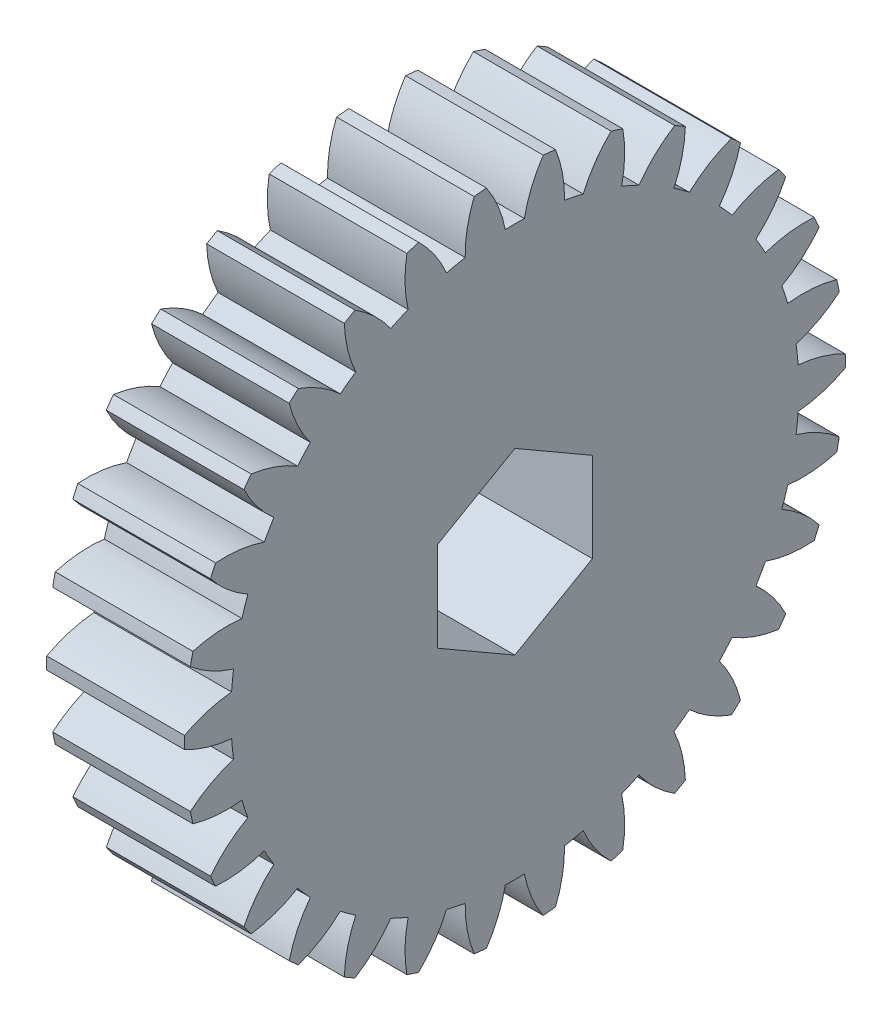
from build123d import *

# Parameters (mm, degrees)
BASPROSKE_W              = 15
BASPROSKE_H              = 24
TOOTHCUT_DEPTH           = 38.107950631
TEETHCUTS_COUNT          = 30
TEETHCUTS_ANGLE          = 348
BORSKE_R                 = 5
BORE_DEPTH               = 50.0000508
CORTE_EXTRUS_O1_DEPTH    = 38.050491393
ESBO_O2_R                = 30.603366169
CORTE_EXTRUS_O2_DEPTH    = 5
ESBO_O4_R                = 9.5
ESBO_O4_R_2              = 7.5
RESSALTO_EXTRUS_O1_DEPTH = 1


with BuildPart() as part:
    # BasProSke → Base-Revolve (revolve)
    with BuildSketch(Plane(origin=(0, 0, 0), x_dir=(1, 0, 0), z_dir=(0, 1, 0)), mode=Mode.PRIVATE) as base_revolve_sk:
        with Locations((7.5, 12)):
            Rectangle(BASPROSKE_W, BASPROSKE_H)
    revolve(base_revolve_sk.sketch.rotate(Axis((-10, 0, 0), (1, 0, 0)), 180), axis=Axis((-10, 0, 0), (1, 0, 0)))

    # TooCutSke → ToothCut (cut, through all)
    with BuildSketch(Plane(origin=(0, 0, 0), x_dir=(0, 0, -1), z_dir=(1, 0, 0))):
        with BuildLine():
            ThreePointArc((0.693278797, 20.612344372), (0, 20.624), (-0.693278797, 20.612344372))
            ThreePointArc((-0.693278797, 20.612344372), (-1.219042225, 22.34383125), (-2.080549663, 23.935144835))
            ThreePointArc((-2.080549663, 23.935144835), (0, 24.0254), (2.080549663, 23.935144835))
            ThreePointArc((2.080549663, 23.935144835), (1.219042225, 22.34383125), (0.693278797, 20.612344372))
        make_face()
    toothcut = extrude(amount=TOOTHCUT_DEPTH, mode=Mode.SUBTRACT)

    # TeethCuts: ToothCut ×30 about axis
    teethcuts_axis = Axis((-10, 0, 0), (1, 0, 0))
    for i in range(1, TEETHCUTS_COUNT):
        add(toothcut.rotate(teethcuts_axis, i * TEETHCUTS_ANGLE / (TEETHCUTS_COUNT - 1)), mode=Mode.SUBTRACT)

    # BorSke → Bore (cut, symmetric)
    with BuildSketch(Plane(origin=(0, 0, 0), x_dir=(0, 0, -1), z_dir=(1, 0, 0))):
        with Locations(Location((0, 0, 0), (0, 0, 180))):
            Circle(BORSKE_R)
    extrude(amount=BORE_DEPTH, both=True, mode=Mode.SUBTRACT)

    # Esboço1 → Corte-extrusão1 (cut, through all)
    with BuildSketch(Plane(origin=(15, 0, 0), x_dir=(0, 0, -1), z_dir=(1, 0, 0))):
        Polygon((0, 6.5), (-5.629165125, 3.25), (-5.629165125, -3.25), (0, -6.5), (5.629165125, -3.25), (5.629165125, 3.25), align=None)
    extrude(amount=-CORTE_EXTRUS_O1_DEPTH, mode=Mode.SUBTRACT)

    # Esboço2 → Corte-extrusão2 (cut)
    with BuildSketch(Plane.ZY):
        Circle(ESBO_O2_R)
    extrude(amount=-CORTE_EXTRUS_O2_DEPTH, mode=Mode.SUBTRACT)

    # Esboço4 → Ressalto-extrusão1 (add)
    with BuildSketch(Plane.ZY.offset(-5)):
        Circle(ESBO_O4_R)
        Circle(ESBO_O4_R_2, mode=Mode.SUBTRACT)
    extrude(amount=RESSALTO_EXTRUS_O1_DEPTH)


solid = part.part
